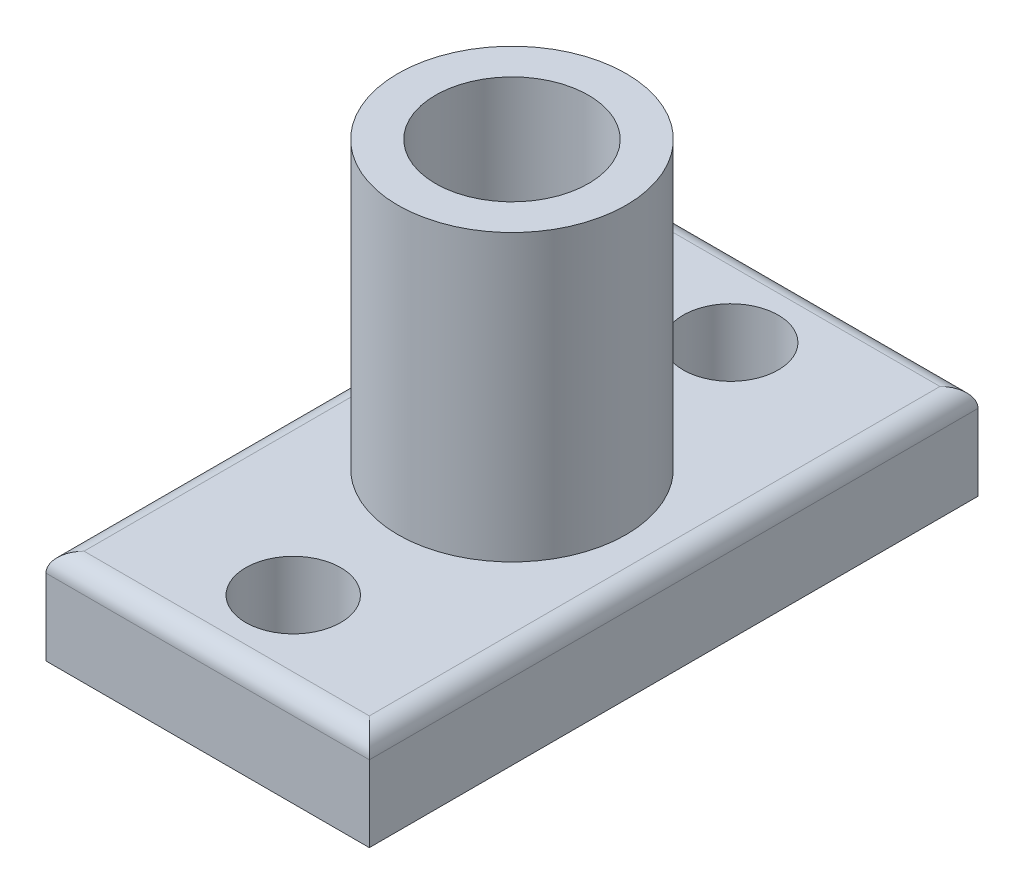
from build123d import *

# Parameters (mm, degrees)
SKETCH1_W           = 17
SKETCH1_H           = 32
SKETCH1_R           = 2.5
BOSS_EXTRUDE1_DEPTH = 5
SKETCH2_R           = 6
SKETCH2_R_2         = 4.025
BOSS_EXTRUDE2_DEPTH = 15
FILLET1_R           = 1


with BuildPart() as part:
    # Sketch1 → Boss-Extrude1 (new body)
    with BuildSketch(Plane(origin=(0, 0, 0), x_dir=(1, 0, 0), z_dir=(0, 1, 0))):
        Rectangle(SKETCH1_W, SKETCH1_H)
        with Locations(Location((0, 11.5, 0), (0, 0, 270))):
            Circle(SKETCH1_R, mode=Mode.SUBTRACT)
        with Locations(Location((0, -11.5, 0), (0, 0, 270))):
            Circle(SKETCH1_R, mode=Mode.SUBTRACT)
    extrude(amount=BOSS_EXTRUDE1_DEPTH)

    # Sketch2 → Boss-Extrude2 (add)
    with BuildSketch(Plane(origin=(0, 5, 0), x_dir=(1, 0, 0), z_dir=(0, 1, 0))):
        with Locations(Location((0, 0, 0), (0, 0, 90))):
            Circle(SKETCH2_R)
        with Locations(Location((0, 0, 0), (0, 0, 270))):
            Circle(SKETCH2_R_2, mode=Mode.SUBTRACT)
    extrude(amount=BOSS_EXTRUDE2_DEPTH)

    # Fillet1
    fillet1_edges = [part.edges().sort_by_distance(p)[0] for p in [
        (-8.5, 5, 0),
        (0, 5, 16),
        (8.5, 5, 0),
        (0, 5, -16),
    ]]
    fillet(fillet1_edges, radius=FILLET1_R)


solid = part.part
